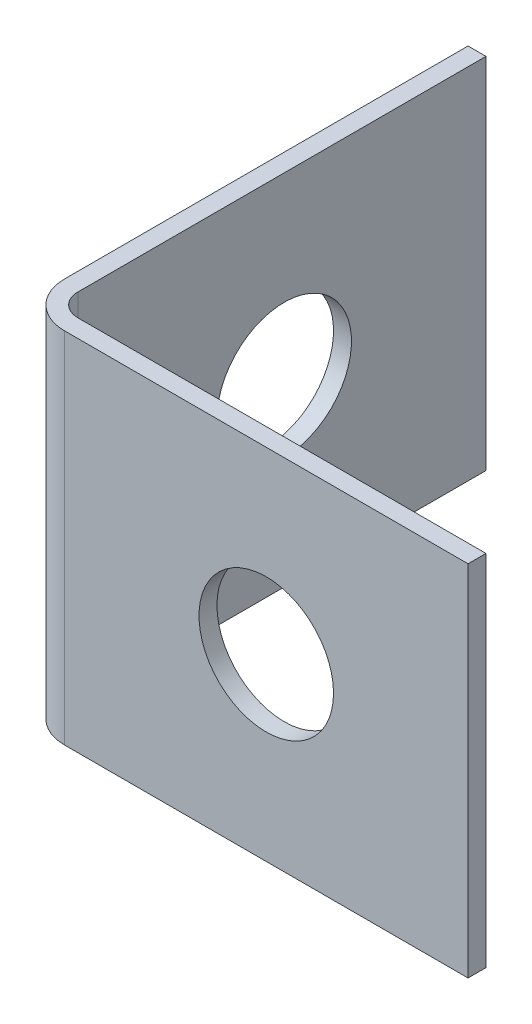
from build123d import *

# Parameters (mm, degrees)
BOSS_EXTRUDE1_DEPTH = 1219.2
SKETCH3_R           = 4.7625
CUT_EXTRUDE1_DEPTH  = 1.27
SKETCH4_R           = 4.7625
CUT_EXTRUDE2_DEPTH  = 1.27
FILLET1_R           = 3.175
FILLET2_R           = 1.5875
CUT_EXTRUDE3_DEPTH  = 1193.8


with BuildPart() as part:
    # Sketch1 → Boss-Extrude1 (new body)
    with BuildSketch(Plane(origin=(0, 0, 0), x_dir=(1, 0, 0), z_dir=(0, 1, 0))):
        Polygon((1.27, 1.27), (1.27, 30.48), (1.27, 31.75), (0, 31.75), (0, 0), (31.75, 0), (31.75, 1.27), (30.48, 1.27), align=None)
    extrude(amount=BOSS_EXTRUDE1_DEPTH)

    # Sketch3 → Cut-Extrude1 (cut)
    with BuildSketch(Plane.ZY):
        with Locations((-17.4625, 12.7)):
            Circle(SKETCH3_R)
        with Locations((-17.4625, 38.1)):
            Circle(SKETCH3_R)
        with Locations((-17.4625, 63.5)):
            Circle(SKETCH3_R)
        with Locations((-17.4625, 88.9)):
            Circle(SKETCH3_R)
        with Locations((-17.4625, 114.3)):
            Circle(SKETCH3_R)
        with Locations((-17.4625, 139.7)):
            Circle(SKETCH3_R)
        with Locations((-17.4625, 165.1)):
            Circle(SKETCH3_R)
        with Locations((-17.4625, 190.5)):
            Circle(SKETCH3_R)
        with Locations((-17.4625, 215.9)):
            Circle(SKETCH3_R)
        with Locations((-17.4625, 241.3)):
            Circle(SKETCH3_R)
        with Locations((-17.4625, 266.7)):
            Circle(SKETCH3_R)
        with Locations((-17.4625, 292.1)):
            Circle(SKETCH3_R)
        with Locations((-17.4625, 317.5)):
            Circle(SKETCH3_R)
        with Locations((-17.4625, 342.9)):
            Circle(SKETCH3_R)
        with Locations((-17.4625, 368.3)):
            Circle(SKETCH3_R)
        with Locations((-17.4625, 393.7)):
            Circle(SKETCH3_R)
        with Locations((-17.4625, 419.1)):
            Circle(SKETCH3_R)
        with Locations((-17.4625, 444.5)):
            Circle(SKETCH3_R)
        with Locations((-17.4625, 469.9)):
            Circle(SKETCH3_R)
        with Locations((-17.4625, 495.3)):
            Circle(SKETCH3_R)
        with Locations((-17.4625, 520.7)):
            Circle(SKETCH3_R)
        with Locations((-17.4625, 546.1)):
            Circle(SKETCH3_R)
        with Locations((-17.4625, 571.5)):
            Circle(SKETCH3_R)
        with Locations((-17.4625, 596.9)):
            Circle(SKETCH3_R)
        with Locations((-17.4625, 622.3)):
            Circle(SKETCH3_R)
        with Locations((-17.4625, 647.7)):
            Circle(SKETCH3_R)
        with Locations((-17.4625, 673.1)):
            Circle(SKETCH3_R)
        with Locations((-17.4625, 698.5)):
            Circle(SKETCH3_R)
        with Locations((-17.4625, 723.9)):
            Circle(SKETCH3_R)
        with Locations((-17.4625, 749.3)):
            Circle(SKETCH3_R)
        with Locations((-17.4625, 774.7)):
            Circle(SKETCH3_R)
        with Locations((-17.4625, 800.1)):
            Circle(SKETCH3_R)
        with Locations((-17.4625, 825.5)):
            Circle(SKETCH3_R)
        with Locations((-17.4625, 850.9)):
            Circle(SKETCH3_R)
        with Locations((-17.4625, 876.3)):
            Circle(SKETCH3_R)
        with Locations((-17.4625, 901.7)):
            Circle(SKETCH3_R)
        with Locations((-17.4625, 927.1)):
            Circle(SKETCH3_R)
        with Locations((-17.4625, 952.5)):
            Circle(SKETCH3_R)
        with Locations((-17.4625, 977.9)):
            Circle(SKETCH3_R)
        with Locations((-17.4625, 1003.3)):
            Circle(SKETCH3_R)
        with Locations((-17.4625, 1028.7)):
            Circle(SKETCH3_R)
        with Locations((-17.4625, 1054.1)):
            Circle(SKETCH3_R)
        with Locations((-17.4625, 1079.5)):
            Circle(SKETCH3_R)
        with Locations((-17.4625, 1104.9)):
            Circle(SKETCH3_R)
        with Locations((-17.4625, 1130.3)):
            Circle(SKETCH3_R)
        with Locations((-17.4625, 1155.7)):
            Circle(SKETCH3_R)
        with Locations((-17.4625, 1181.1)):
            Circle(SKETCH3_R)
        with Locations((-17.4625, 1206.5)):
            Circle(SKETCH3_R)
    extrude(amount=-CUT_EXTRUDE1_DEPTH, mode=Mode.SUBTRACT)

    # Sketch4 → Cut-Extrude2 (cut)
    with BuildSketch(Plane.XY):
        with Locations((17.4625, 1206.5)):
            Circle(SKETCH4_R)
        with Locations((17.4625, 1181.1)):
            Circle(SKETCH4_R)
        with Locations((17.4625, 1155.7)):
            Circle(SKETCH4_R)
        with Locations((17.4625, 1130.3)):
            Circle(SKETCH4_R)
        with Locations((17.4625, 1104.9)):
            Circle(SKETCH4_R)
        with Locations((17.4625, 1079.5)):
            Circle(SKETCH4_R)
        with Locations((17.4625, 1054.1)):
            Circle(SKETCH4_R)
        with Locations((17.4625, 1028.7)):
            Circle(SKETCH4_R)
        with Locations((17.4625, 1003.3)):
            Circle(SKETCH4_R)
        with Locations((17.4625, 977.9)):
            Circle(SKETCH4_R)
        with Locations((17.4625, 952.5)):
            Circle(SKETCH4_R)
        with Locations((17.4625, 927.1)):
            Circle(SKETCH4_R)
        with Locations((17.4625, 901.7)):
            Circle(SKETCH4_R)
        with Locations((17.4625, 876.3)):
            Circle(SKETCH4_R)
        with Locations((17.4625, 850.9)):
            Circle(SKETCH4_R)
        with Locations((17.4625, 825.5)):
            Circle(SKETCH4_R)
        with Locations((17.4625, 800.1)):
            Circle(SKETCH4_R)
        with Locations((17.4625, 774.7)):
            Circle(SKETCH4_R)
        with Locations((17.4625, 749.3)):
            Circle(SKETCH4_R)
        with Locations((17.4625, 723.9)):
            Circle(SKETCH4_R)
        with Locations((17.4625, 698.5)):
            Circle(SKETCH4_R)
        with Locations((17.4625, 673.1)):
            Circle(SKETCH4_R)
        with Locations((17.4625, 647.7)):
            Circle(SKETCH4_R)
        with Locations((17.4625, 622.3)):
            Circle(SKETCH4_R)
        with Locations((17.4625, 596.9)):
            Circle(SKETCH4_R)
        with Locations((17.4625, 571.5)):
            Circle(SKETCH4_R)
        with Locations((17.4625, 546.1)):
            Circle(SKETCH4_R)
        with Locations((17.4625, 520.7)):
            Circle(SKETCH4_R)
        with Locations((17.4625, 495.3)):
            Circle(SKETCH4_R)
        with Locations((17.4625, 469.9)):
            Circle(SKETCH4_R)
        with Locations((17.4625, 444.5)):
            Circle(SKETCH4_R)
        with Locations((17.4625, 419.1)):
            Circle(SKETCH4_R)
        with Locations((17.4625, 393.7)):
            Circle(SKETCH4_R)
        with Locations((17.4625, 368.3)):
            Circle(SKETCH4_R)
        with Locations((17.4625, 342.9)):
            Circle(SKETCH4_R)
        with Locations((17.4625, 317.5)):
            Circle(SKETCH4_R)
        with Locations((17.4625, 292.1)):
            Circle(SKETCH4_R)
        with Locations((17.4625, 266.7)):
            Circle(SKETCH4_R)
        with Locations((17.4625, 241.3)):
            Circle(SKETCH4_R)
        with Locations((17.4625, 215.9)):
            Circle(SKETCH4_R)
        with Locations((17.4625, 190.5)):
            Circle(SKETCH4_R)
        with Locations((17.4625, 165.1)):
            Circle(SKETCH4_R)
        with Locations((17.4625, 139.7)):
            Circle(SKETCH4_R)
        with Locations((17.4625, 114.3)):
            Circle(SKETCH4_R)
        with Locations((17.4625, 88.9)):
            Circle(SKETCH4_R)
        with Locations((17.4625, 63.5)):
            Circle(SKETCH4_R)
        with Locations((17.4625, 38.1)):
            Circle(SKETCH4_R)
        with Locations((17.4625, 12.7)):
            Circle(SKETCH4_R)
    extrude(amount=-CUT_EXTRUDE2_DEPTH, mode=Mode.SUBTRACT)

    # Fillet1
    fillet1_edges = [part.edges().sort_by_distance(p)[0] for p in [
        (0, 609.6, 0),
    ]]
    fillet(fillet1_edges, radius=FILLET1_R)

    # Fillet2
    fillet2_edges = [part.edges().sort_by_distance(p)[0] for p in [
        (1.27, 609.6, -1.27),
    ]]
    fillet(fillet2_edges, radius=FILLET2_R)

    # Sketch5 → Cut-Extrude3 (cut)
    with BuildSketch(Plane(origin=(0, 1219.2, 0), x_dir=(1, 0, 0), z_dir=(0, 1, 0))):
        with BuildLine():
            Line((0, 31.75), (0, 3.175))
            ThreePointArc((0, 3.175), (0.92993597, 0.92993597), (3.175, 0))
            Line((3.175, 0), (31.75, 0))
            Line((31.75, 0), (31.75, 1.27))
            Line((31.75, 1.27), (2.8575, 1.27))
            ThreePointArc((2.8575, 1.27), (1.734967985, 1.734967985), (1.27, 2.8575))
            Line((1.27, 2.8575), (1.27, 31.75))
            Line((1.27, 31.75), (0, 31.75))
        make_face()
    extrude(amount=-CUT_EXTRUDE3_DEPTH, mode=Mode.SUBTRACT)


solid = part.part
